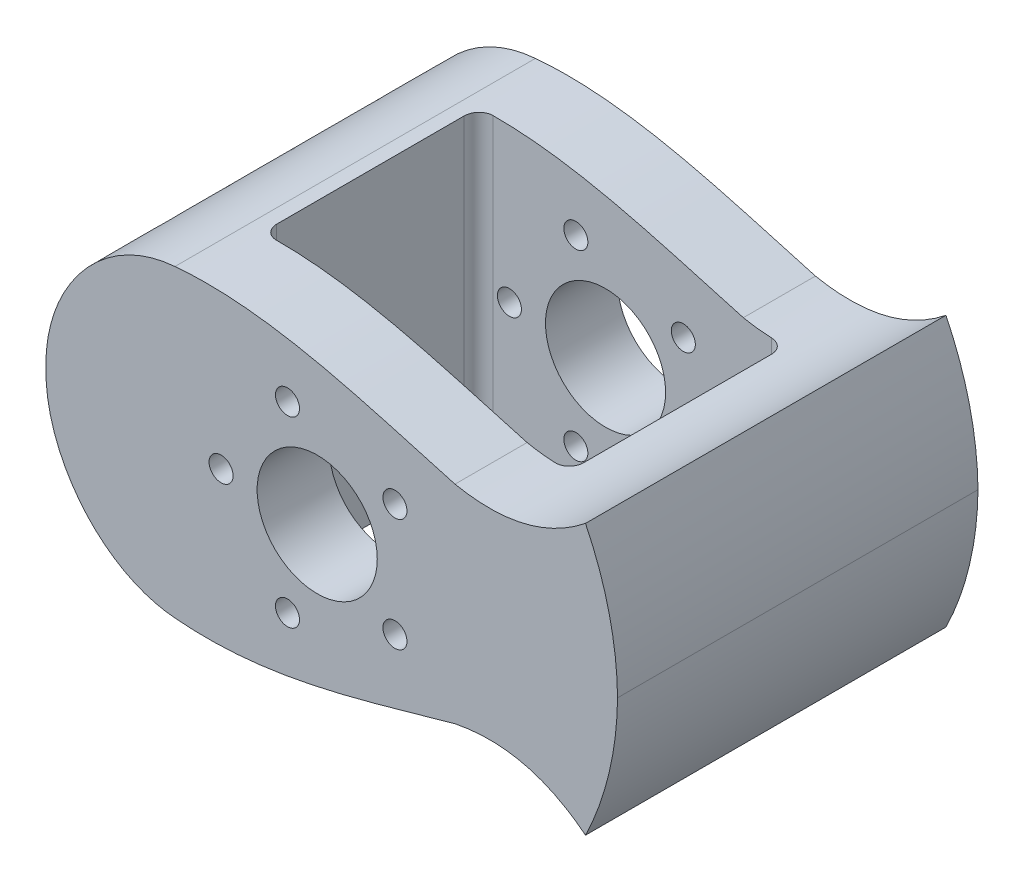
from build123d import *

# Parameters (mm, degrees)
RESSALTO_EXTRUS_O1_DEPTH                = 75
CORTE_EXTRUS_O1_DEPTH                   = 70
CORTE_EXTRUS_O1_DEPTH_BACK              = 70
ESBO_O2_W                               = 63.930126489
ESBO_O2_H                               = 45
ESBO_O3_R                               = 12.5
CORTE_EXTRUS_O2_DEPTH                   = 103.728030149
FILETE1_R                               = 3
BROCA_DE_ROSQUEAR_PARA_TARRAXA_DE_M61_D = 5


with BuildPart() as part:
    # Esboço1 → Ressalto-extrusão1 (new body)
    with BuildSketch(Plane.XY):
        with BuildLine():
            ThreePointArc((55.829329515, 28.095123526), (60.733716713, 14.420104299), (62.5, 0))
            ThreePointArc((62.5, 0), (60.733716713, -14.420104299), (55.829329515, -28.095123526))
            add(Edge.make_bspline(
                [(28.676911595, -21.588340477), (43.861491247, -18.534041768), (55.829329515, -28.095123526)],
                knots=[0, 0, 0, 1, 1, 1], degree=2))
            add(Edge.make_bspline(
                [(-29.594432007, -31.676619774), (-9.724198858, -33.439461038), (9.873119669, -26.770904045), (28.676911595, -21.588340477)],
                knots=[0, 0, 0, 0, 1, 1, 1, 1], degree=3))
            add(Edge.make_bspline(
                [(-56.430126489, 0), (-56.804873179, -15.057396007), (-45.200173771, -30.412276657), (-29.594432007, -31.676619774)],
                knots=[0, 0, 0, 0, 1, 1, 1, 1], degree=3))
            add(Edge.make_bspline(
                [(-56.430126489, 0), (-56.804873179, 15.057396007), (-45.200173771, 30.412276657), (-29.594432007, 31.676619774)],
                knots=[0, 0, 0, 0, 1, 1, 1, 1], degree=3))
            add(Edge.make_bspline(
                [(-29.594432007, 31.676619774), (-9.724198858, 33.439461038), (9.873119669, 26.770904045), (28.676911595, 21.588340477)],
                knots=[0, 0, 0, 0, 1, 1, 1, 1], degree=3))
            add(Edge.make_bspline(
                [(28.676911595, 21.588340477), (43.861491247, 18.534041768), (55.829329515, 28.095123526)],
                knots=[0, 0, 0, 1, 1, 1], degree=2))
        make_face()
    extrude(amount=RESSALTO_EXTRUS_O1_DEPTH)

    # Esboço2 → Corte-extrusão1 (cut, two sides: drawn at the far end of the back side and taken through both)
    with BuildSketch(Plane(origin=(0, 0, 0), x_dir=(1, 0, 0), z_dir=(0, 1, 0)).offset(-CORTE_EXTRUS_O1_DEPTH_BACK)):
        with Locations((5.534936755, -37.5)):
            Rectangle(ESBO_O2_W, ESBO_O2_H)
    extrude(amount=CORTE_EXTRUS_O1_DEPTH + CORTE_EXTRUS_O1_DEPTH_BACK, mode=Mode.SUBTRACT)

    # Esboço3 → Corte-extrusão2 (cut, through all)
    with BuildSketch(Plane.XY.offset(75)):
        Circle(ESBO_O3_R)
    extrude(amount=-CORTE_EXTRUS_O2_DEPTH, mode=Mode.SUBTRACT)

    # Filete1
    filete1_edges = [part.edges().sort_by_distance(p)[0] for p in [
        (37.5, 0, 60),
        (37.5, 0, 15),
        (-26.430126489, 0, 60),
        (-26.430126489, 0, 15),
    ]]
    fillet(filete1_edges, radius=FILETE1_R)

    # Broca de rosquear para tarraxa de M61 (through all)
    with Locations(Plane.XY.offset(75)):
        with Locations((-6.180339887, 19.021130326), (16.180339887, 11.755705046), (16.180339888, -11.755705046), (-6.180339887, -19.021130326), (-20, 0)):
            Hole(BROCA_DE_ROSQUEAR_PARA_TARRAXA_DE_M61_D / 2)


solid = part.part
